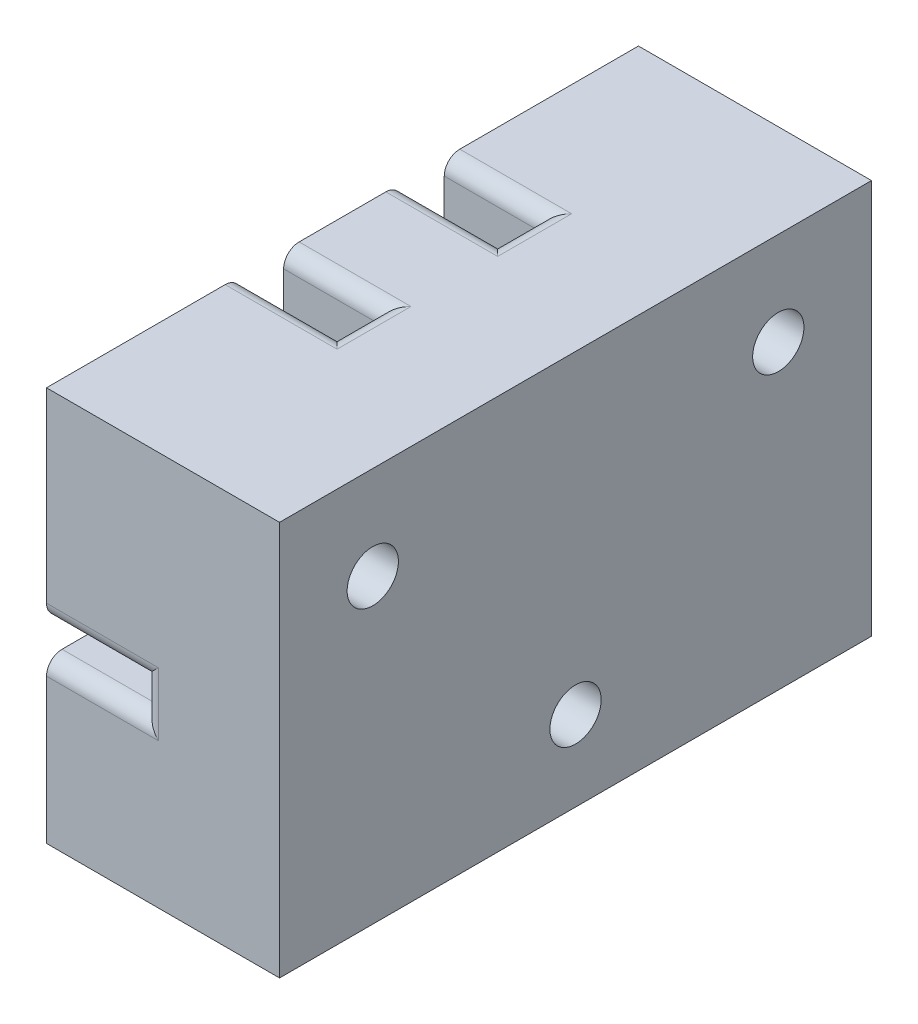
from build123d import *

# Parameters (mm, degrees)
SKETCH1_W           = 38.1
SKETCH1_H           = 25.4
SKETCH1_R           = 1.65
BOSS_EXTRUDE2_DEPTH = 15
CUT_EXTRUDE1_DEPTH  = 6.2
FILLET1_R           = 1


with BuildPart() as part:
    # Sketch1 → Boss-Extrude2 (new body)
    with BuildSketch(Plane(origin=(0, 0, 0), x_dir=(0, 0, -1), z_dir=(1, 0, 0))):
        with Locations((19.05, 12.7)):
            Rectangle(SKETCH1_W, SKETCH1_H)
        with Locations((6, 19.4)):
            Circle(SKETCH1_R, mode=Mode.SUBTRACT)
        with Locations((19.05, 5.1625)):
            Circle(SKETCH1_R, mode=Mode.SUBTRACT)
        with Locations((32.1, 19.4)):
            Circle(SKETCH1_R, mode=Mode.SUBTRACT)
    extrude(amount=BOSS_EXTRUDE2_DEPTH)

    # Sketch1<9> → Cut-Extrude1 (cut)
    with BuildSketch(Plane(origin=(0, 0, 0), x_dir=(0, 0, -1), z_dir=(1, 0, 0))):
        Polygon((12.5, 12.395), (0, 12.395), (0, 10.325), (15.26, 10.325), (15.26, 25.4), (12.5, 25.4), align=None)
        Polygon((25.6, 25.4), (22.84, 25.4), (22.84, 10.325), (38.1, 10.325), (38.1, 12.395), (25.6, 12.395), align=None)
    extrude(amount=CUT_EXTRUDE1_DEPTH, mode=Mode.SUBTRACT)

    # Fillet1
    fillet1_edges = [part.edges().sort_by_distance(p)[0] for p in [
        (6.2, 25.4, -24.22),
        (6.2, 25.4, -13.88),
        (6.2, 11.36, -38.1),
        (6.2, 11.36, 0),
        (3.1, 25.4, -25.6),
        (3.1, 25.4, -22.84),
        (3.1, 25.4, -12.5),
        (3.1, 25.4, -15.26),
        (3.1, 10.325, 0),
        (3.1, 12.395, 0),
        (3.1, 12.395, -12.5),
        (3.1, 10.325, -15.26),
        (3.1, 10.325, -22.84),
        (3.1, 12.395, -25.6),
        (3.1, 10.325, -38.1),
        (3.1, 12.395, -38.1),
    ]]
    fillet(fillet1_edges, radius=FILLET1_R)


solid = part.part
